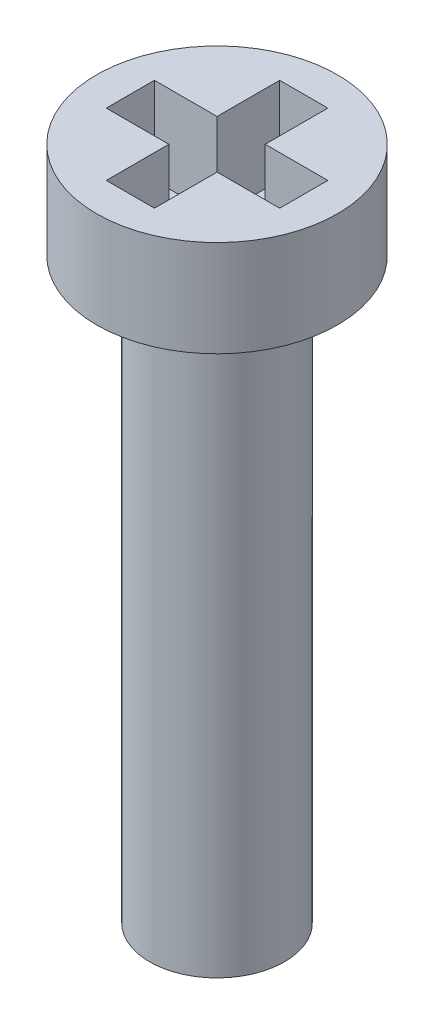
from build123d import *

# Parameters (mm, degrees)
SKETCH1_R           = 1.25
BOSS_EXTRUDE1_DEPTH = 1
SKETCH2_R           = 1.25
BOSS_EXTRUDE2_DEPTH = 0.1
SKETCH3_R           = 0.7
BOSS_EXTRUDE3_DEPTH = 6


with BuildPart() as part:
    # Sketch1 → Boss-Extrude1 (new body)
    with BuildSketch(Plane(origin=(0, 0, 0), x_dir=(1, 0, 0), z_dir=(0, 1, 0))):
        with Locations(Location((0, 0, 0), (0, 0, 270))):
            Circle(SKETCH1_R)
        Polygon((-0.25, -0.25), (-0.9, -0.25), (-0.9, 0.25), (-0.25, 0.25), (-0.25, 0.9), (0.25, 0.9), (0.25, 0.25), (0.9, 0.25), (0.9, -0.25), (0.25, -0.25), (0.25, -0.9), (-0.25, -0.9), align=None, mode=Mode.SUBTRACT)
    extrude(amount=BOSS_EXTRUDE1_DEPTH)

    # Sketch2 → Boss-Extrude2 (add)
    with BuildSketch(Plane.XZ):
        with Locations(Location((0, 0, 0), (0, 0, 90))):
            Circle(SKETCH2_R)
    extrude(amount=-BOSS_EXTRUDE2_DEPTH)

    # Sketch3 → Boss-Extrude3 (add)
    with BuildSketch(Plane.XZ):
        with Locations(Location((0, 0, 0), (0, 0, 270))):
            Circle(SKETCH3_R)
    extrude(amount=BOSS_EXTRUDE3_DEPTH)


solid = part.part
